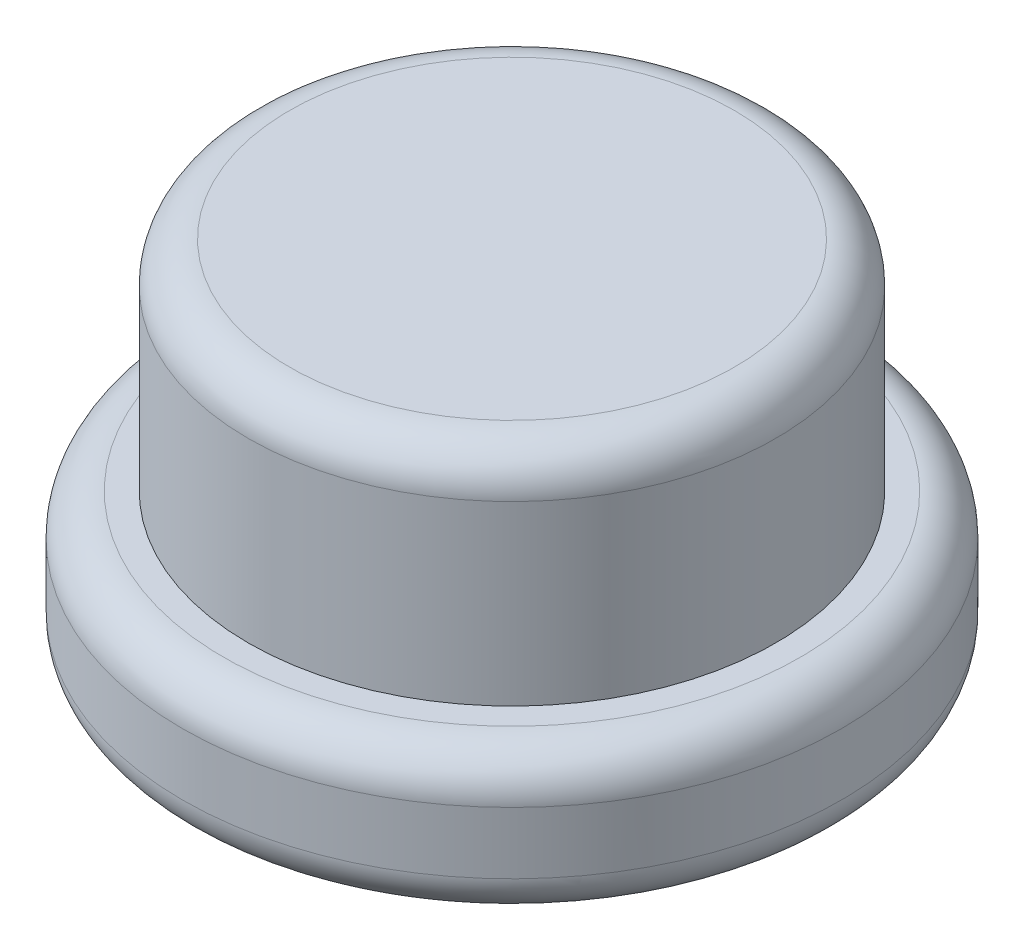
from build123d import *

# Parameters (mm, degrees)
CONG_1_R = 1


with BuildPart() as part:
    # Esquisse1 → Révolution1 (revolve)
    with BuildSketch(Plane.XY, mode=Mode.PRIVATE) as r_volution1_sk:
        with BuildLine():
            Line((3, 1.2), (8, 1.2))
            Line((8, 1.2), (8, 4.7))
            Line((8, 4.7), (6.4, 4.7))
            Line((6.4, 4.7), (6.4, 10))
            Line((6.4, 10), (0, 10))
            Line((0, 10), (0, 0))
            ThreePointArc((0, 0), (1.615549442, 0.311126395), (3, 1.2))
        make_face()
    revolve(r_volution1_sk.sketch.rotate(Axis((0, 10, 0), (0, -1, 0)), 90), axis=Axis((0, 10, 0), (0, -1, 0)))

    # Congé1
    cong_1_edges = [part.edges().sort_by_distance(p)[0] for p in [
        (0, 10, -6.4),
        (0, 4.7, -8),
        (0, 1.2, -8),
    ]]
    fillet(cong_1_edges, radius=CONG_1_R)


solid = part.part
